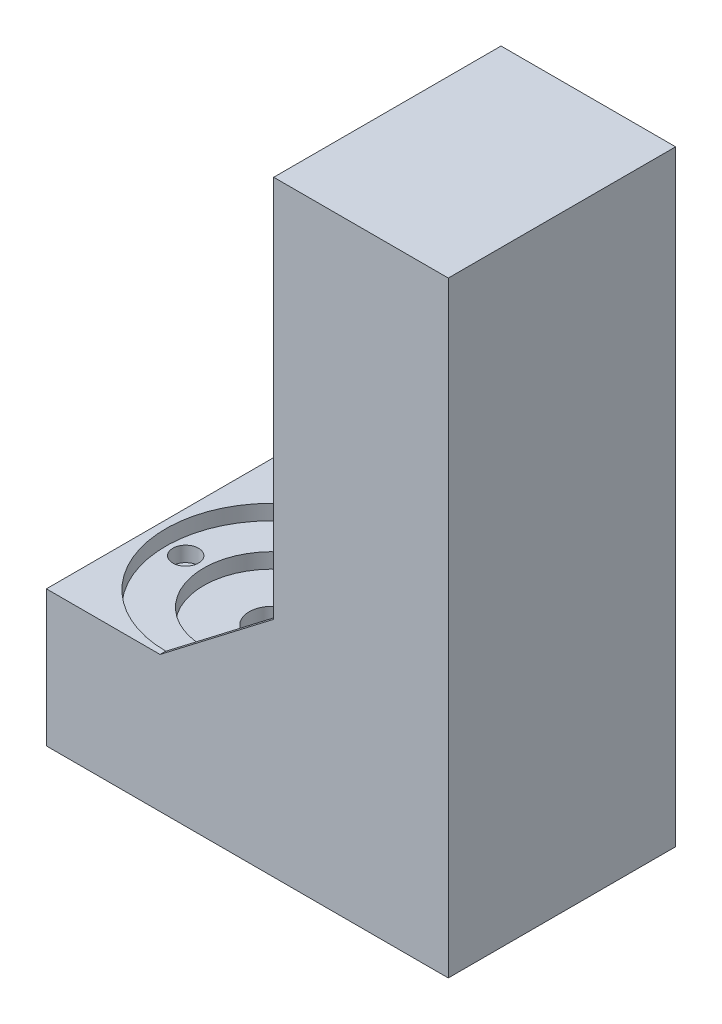
from build123d import *

# Parameters (mm, degrees)
SKETCH1_W           = 30
SKETCH1_H           = 17.96
BOSS_EXTRUDE1_DEPTH = 30
SKETCH2_R           = 14
CUT_EXTRUDE1_DEPTH  = 2
SKETCH3_R           = 1.7
CUT_EXTRUDE2_DEPTH  = 2
SKETCH4_R           = 9
CUT_EXTRUDE3_DEPTH  = 2
SKETCH5_R           = 3
CUT_EXTRUDE6_DEPTH  = 90.858350753
CUT_EXTRUDE7_DEPTH  = 2
BOSS_EXTRUDE2_DEPTH = 1
EXTRUDE_THIN1_DEPTH = 0.7


with BuildPart() as part:
    # Sketch1 → Boss-Extrude1 (new body)
    with BuildSketch(Plane.XY):
        with Locations((15, 8.98)):
            Rectangle(SKETCH1_W, SKETCH1_H)
        Polygon((30, 17.96), (30, 0), (53.04, 0), (53.04, 80), (30, 80), align=None)
    extrude(amount=BOSS_EXTRUDE1_DEPTH)

    # Sketch2 → Cut-Extrude1 (cut)
    with BuildSketch(Plane(origin=(0, 17.96, 0), x_dir=(1, 0, 0), z_dir=(0, 1, 0))):
        with Locations(Location((15, -15.240313603, 0), (0, 0, 270))):
            Circle(SKETCH2_R)
    extrude(amount=-CUT_EXTRUDE1_DEPTH, mode=Mode.SUBTRACT)

    # Sketch3 → Cut-Extrude2 (cut)
    with BuildSketch(Plane(origin=(0, 15.96, 0), x_dir=(1, 0, 0), z_dir=(0, 1, 0))):
        with Locations(Location((15, -3.4, 0), (0, 0, 270))):
            Circle(SKETCH3_R)
        with Locations(Location((26.6, -14.898975901, 0), (0, 0, 270))):
            Circle(SKETCH3_R)
        with Locations(Location((14.997277846, -26.6, 0), (0, 0, 270))):
            Circle(SKETCH3_R)
        with Locations(Location((3.4, -15.0181958, 0), (0, 0, 270))):
            Circle(SKETCH3_R)
    extrude(amount=-CUT_EXTRUDE2_DEPTH, mode=Mode.SUBTRACT)

    # Sketch4 → Cut-Extrude3 (cut)
    with BuildSketch(Plane(origin=(0, 15.96, 0), x_dir=(1, 0, 0), z_dir=(0, 1, 0))):
        with Locations(Location((15, -15.240313603, 0), (0, 0, 270))):
            Circle(SKETCH4_R)
    extrude(amount=-CUT_EXTRUDE3_DEPTH, mode=Mode.SUBTRACT)

    # Sketch5 → Cut-Extrude6 (cut, through all)
    with BuildSketch(Plane(origin=(0, 13.96, 0), x_dir=(1, 0, 0), z_dir=(0, 1, 0))):
        with Locations(Location((15, -15.240313603, 0), (0, 0, 270))):
            Circle(SKETCH5_R)
    extrude(amount=-CUT_EXTRUDE6_DEPTH, mode=Mode.SUBTRACT)

    # Sketch6 → Cut-Extrude7 (cut)
    with BuildSketch(Plane.ZY.offset(-30)):
        with BuildLine():
            Line((4.639681938, 75.339266158), (4.639681938, 30.209714413))
            ThreePointArc((4.639681938, 30.209714413), (6.339681938, 28.509714413), (8.039681938, 30.209714413))
            Line((8.039681938, 30.209714413), (8.039681938, 75.339266158))
            ThreePointArc((8.039681938, 75.339266158), (6.339681938, 77.039266158), (4.639681938, 75.339266158))
        make_face()
        with BuildLine():
            Line((21.70723863, 75.339266158), (21.70723863, 30.209714413))
            ThreePointArc((21.70723863, 30.209714413), (23.40723863, 28.509714413), (25.10723863, 30.209714413))
            Line((25.10723863, 30.209714413), (25.10723863, 75.339266158))
            ThreePointArc((25.10723863, 75.339266158), (23.40723863, 77.039266158), (21.70723863, 75.339266158))
        make_face()
    extrude(amount=-CUT_EXTRUDE7_DEPTH, mode=Mode.SUBTRACT)

    # Sketch7 → Boss-Extrude2 (add)
    with BuildSketch(Plane(origin=(0, 0, 0), x_dir=(-1, 0, 0), z_dir=(0, 0, -1))):
        Polygon((-15, 17.96), (-30, 29.475844043), (-30, 17.96), align=None)
    extrude(amount=-BOSS_EXTRUDE2_DEPTH)

    # Sketch8 → Extrude-Thin1 (add)
    with BuildSketch(Plane.XY.offset(30)):
        Polygon((15, 17.96), (30, 29.475844043), (36.089590867, 21.543827713), (21.089590867, 10.027983669), align=None)
    extrude(amount=-EXTRUDE_THIN1_DEPTH)


solid = part.part
